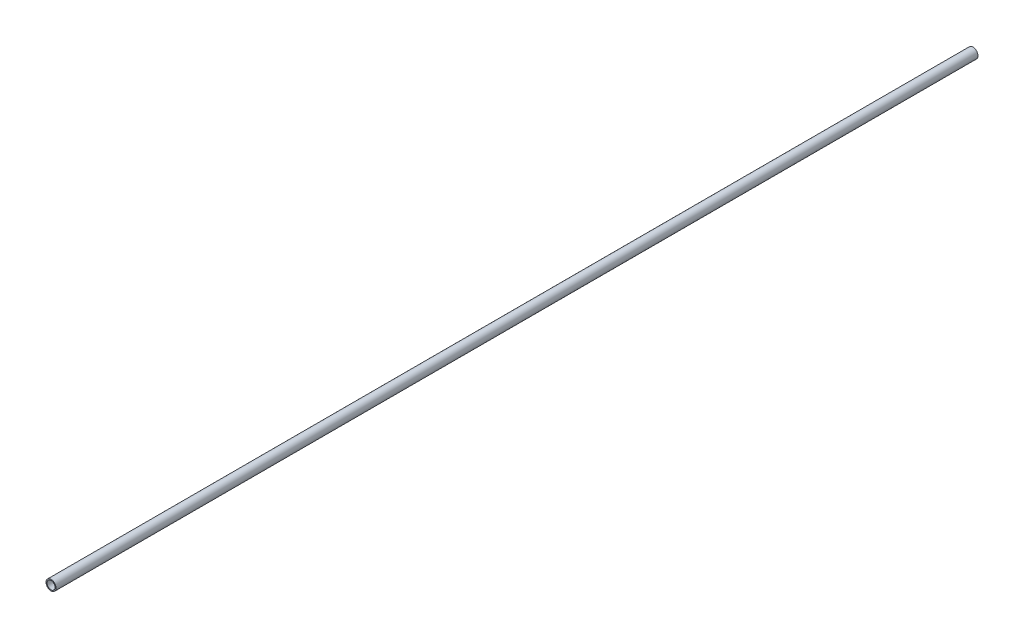
from build123d import *

# Parameters (mm, degrees)
SKETCH1_R           = 5
SKETCH1_R_2         = 4
BOSS_EXTRUDE1_DEPTH = 457.2


with BuildPart() as part:
    # Sketch1 → Boss-Extrude1 (new, symmetric)
    with BuildSketch(Plane.XY):
        Circle(SKETCH1_R)
        Circle(SKETCH1_R_2, mode=Mode.SUBTRACT)
    extrude(amount=BOSS_EXTRUDE1_DEPTH, both=True)


solid = part.part
